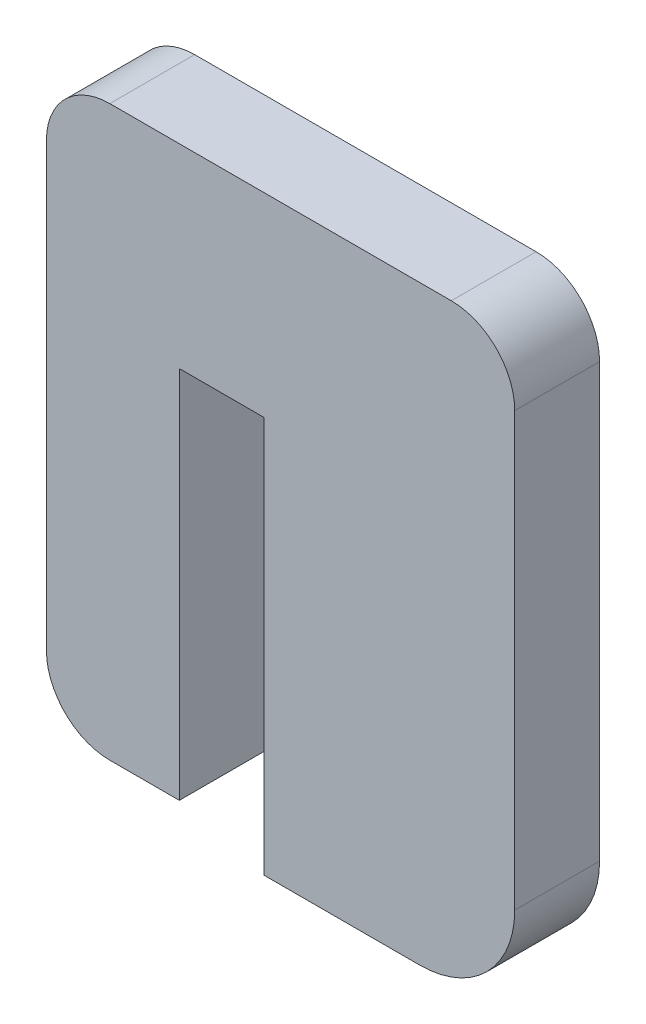
from build123d import *

# Parameters (mm, degrees)
BOSS_EXTRUDE1_DEPTH = 5.35


with BuildPart() as part:
    # Model → Boss-Extrude1 (new body)
    with BuildSketch(Plane.XY):
        with BuildLine():
            Line((23.530324921, 0), (13.730324805, 0))
            Line((13.730324805, 0), (13.730324805, 25.000000373))
            Line((13.730324805, 25.000000373), (8.38032458, 25.000000373))
            Line((8.38032458, 25.000000373), (8.38032458, 1.418154687))
            Line((8.38032458, 1.418154687), (4, 1.418154687))
            ThreePointArc((4, 1.418154687), (1.171572808, 2.589727629), (0, 5.418154877))
            Line((0, 5.418154877), (0, 33.278149277))
            ThreePointArc((0, 33.278149277), (1.171572778, 36.106576304), (3.999999724, 37.278149277))
            Line((3.999999724, 37.278149277), (25.530324042, 37.278149277))
            ThreePointArc((25.530324042, 37.278149277), (28.358750081, 36.106577487), (29.530324042, 33.278152347))
            Line((29.530324042, 33.278152347), (29.530324042, 6))
            ThreePointArc((29.530324042, 6), (27.77296504, 1.757359624), (23.530324921, 0))
        make_face()
    extrude(amount=BOSS_EXTRUDE1_DEPTH)


solid = part.part
